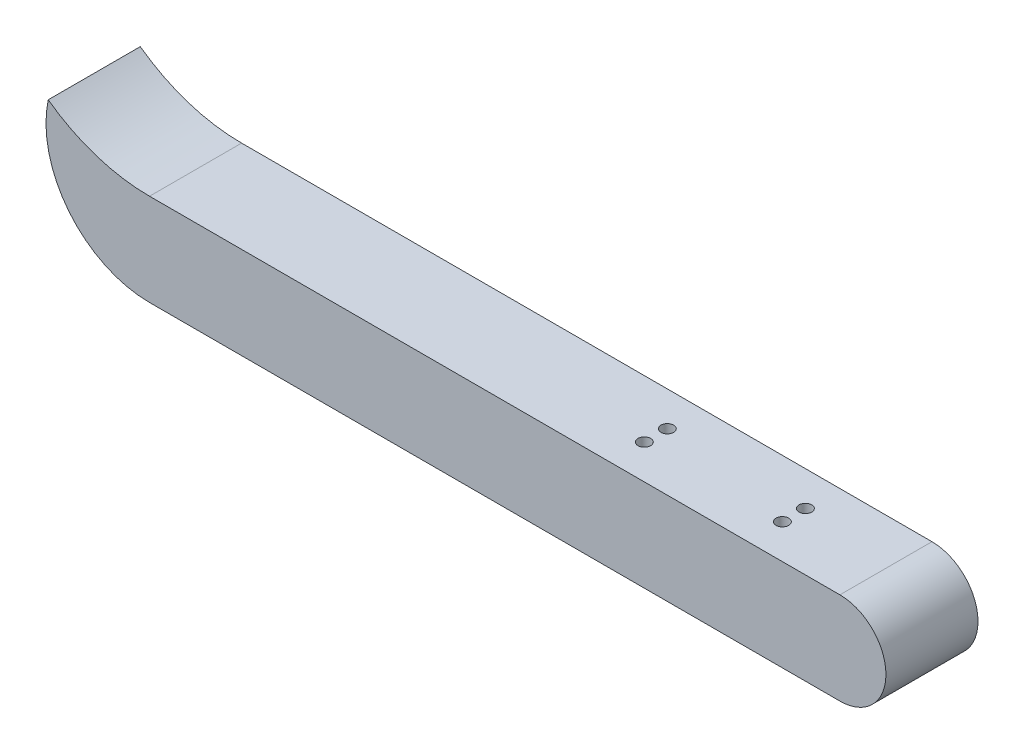
from build123d import *

# Parameters (mm, degrees)
BOSS_EXTRUDE1_DEPTH                     = 40
CBORE_FOR_M5_HEX_HEAD_BOLT3_D           = 5.5
CBORE_FOR_M5_HEX_HEAD_BOLT3_CBORE_D     = 12.24
CBORE_FOR_M5_HEX_HEAD_BOLT3_CBORE_DEPTH = 3.58


with BuildPart() as part:
    # Sketch1 → Boss-Extrude1 (new body)
    with BuildSketch(Plane.XY):
        with BuildLine():
            Line((0, 0), (300, 0))
            ThreePointArc((300, 0), (320, 20), (300, 40))
            Line((300, 40), (0, 40))
            ThreePointArc((0, 40), (-23.145502494, 43.660770159), (-44.031528593, 54.285714286))
            ThreePointArc((-44.031528593, 54.285714286), (-34.948942351, 16.652664524), (0, 0))
        make_face()
    extrude(amount=BOSS_EXTRUDE1_DEPTH)

    # CBORE for M5 Hex Head Bolt3 (through all)
    with Locations(Plane(origin=(0, 0, 0), x_dir=(-1, 0, 0), z_dir=(0, -1, 0))):
        with Locations((-260, -15), (-260, -25), (-200, -25), (-200, -15)):
            CounterBoreHole(CBORE_FOR_M5_HEX_HEAD_BOLT3_D / 2, CBORE_FOR_M5_HEX_HEAD_BOLT3_CBORE_D / 2, CBORE_FOR_M5_HEX_HEAD_BOLT3_CBORE_DEPTH)


solid = part.part
